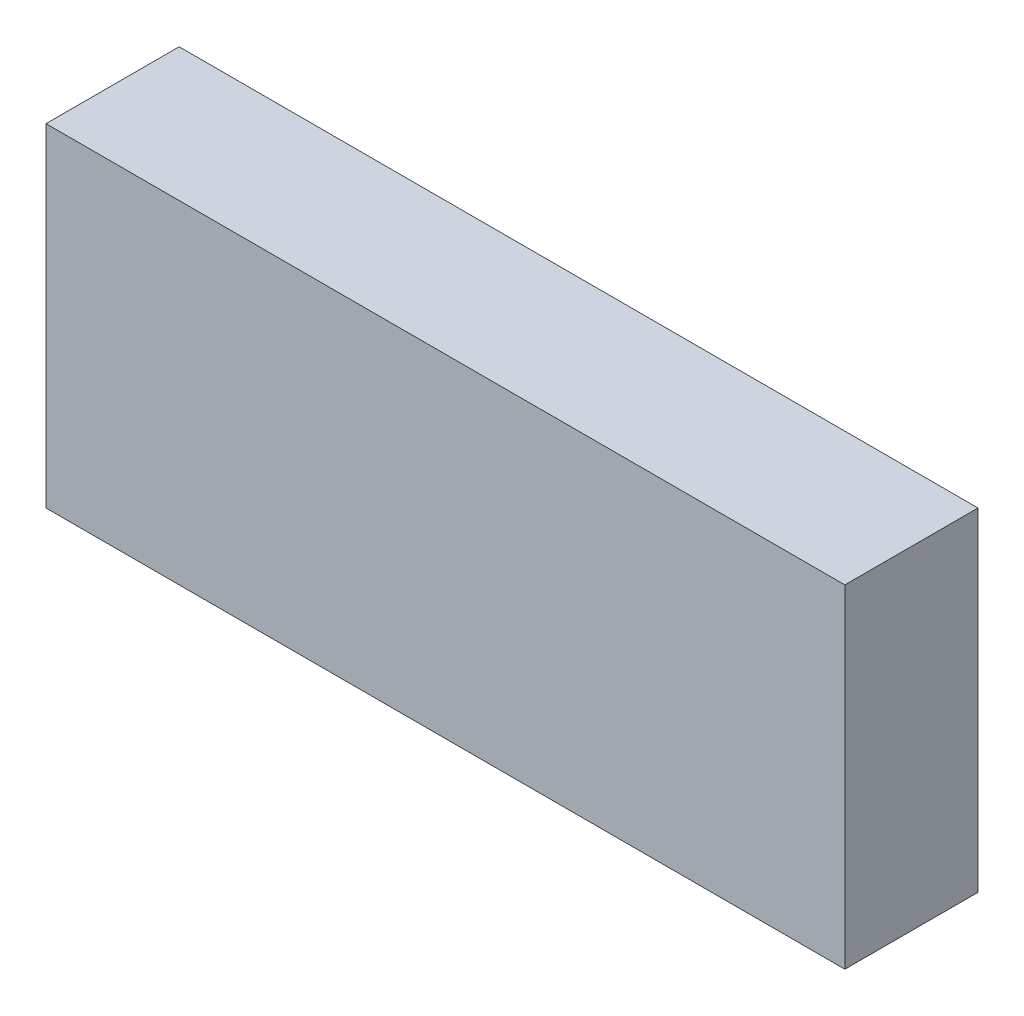
from build123d import *

# Parameters (mm, degrees)
SKETCH1_W           = 60
SKETCH1_H           = 25
BOSS_EXTRUDE1_DEPTH = 10


with BuildPart() as part:
    # Sketch1 → Boss-Extrude1 (new body)
    with BuildSketch(Plane.XY):
        with Locations((0, 12.5)):
            Rectangle(SKETCH1_W, SKETCH1_H)
    extrude(amount=BOSS_EXTRUDE1_DEPTH)


solid = part.part
